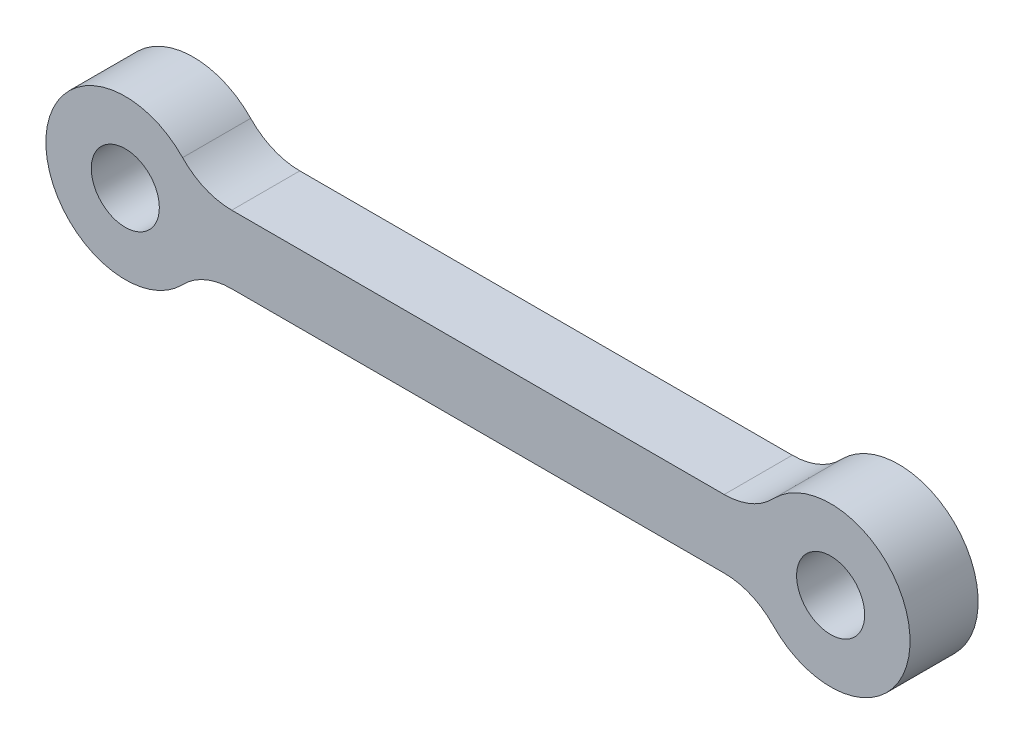
from build123d import *

# Parameters (mm, degrees)
SKETCH1_R           = 1.5
BOSS_EXTRUDE1_DEPTH = 3


with BuildPart() as part:
    # Sketch1 → Boss-Extrude1 (new body)
    with BuildSketch(Plane.XY):
        with BuildLine():
            Line((4.69041576, 1.5), (26.38958424, 1.5))
            ThreePointArc((26.38958424, 1.5), (27.566281051, 1.740401367), (28.554391514, 2.423076923))
            ThreePointArc((28.554391514, 2.423076923), (34.58, 0), (28.554391514, -2.423076923))
            ThreePointArc((28.554391514, -2.423076923), (27.566281051, -1.740401367), (26.38958424, -1.5))
            Line((26.38958424, -1.5), (4.69041576, -1.5))
            ThreePointArc((4.69041576, -1.5), (3.513718949, -1.740401367), (2.525608486, -2.423076923))
            ThreePointArc((2.525608486, -2.423076923), (-3.5, 0), (2.525608486, 2.423076923))
            ThreePointArc((2.525608486, 2.423076923), (3.513718949, 1.740401367), (4.69041576, 1.5))
        make_face()
        Circle(SKETCH1_R, mode=Mode.SUBTRACT)
        with Locations((31.08, 0)):
            Circle(SKETCH1_R, mode=Mode.SUBTRACT)
    extrude(amount=BOSS_EXTRUDE1_DEPTH)


solid = part.part
